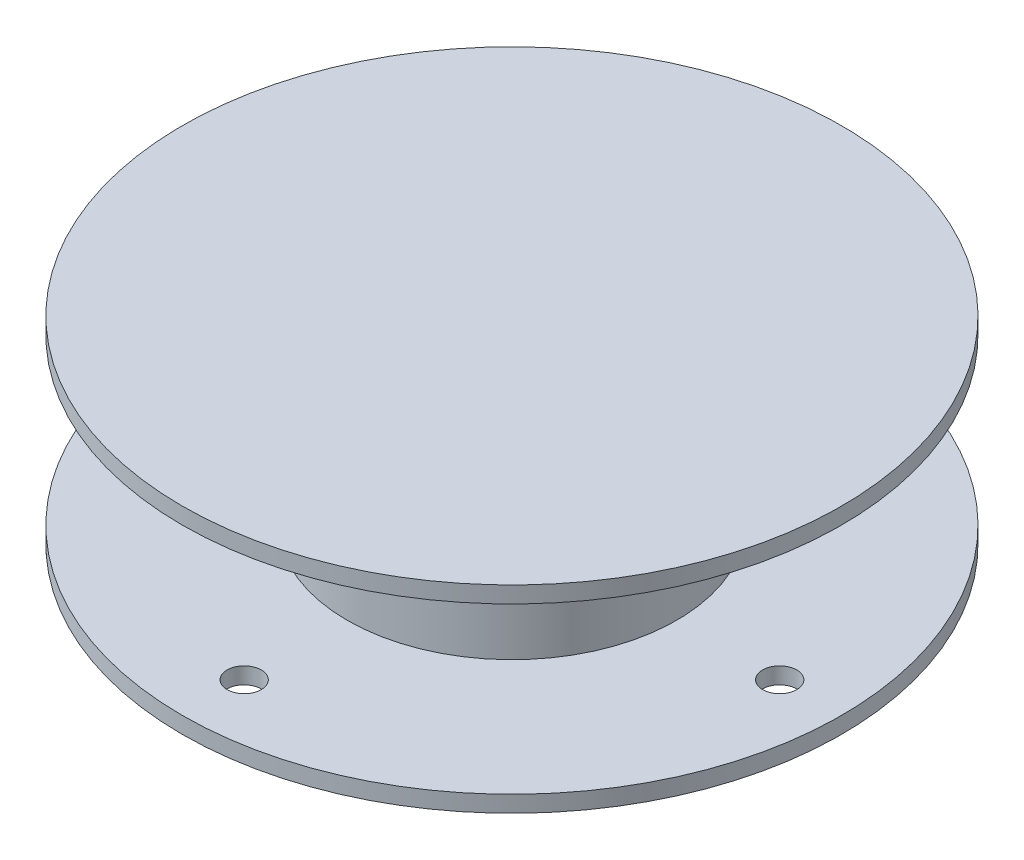
from build123d import *

# Parameters (mm, degrees)
SKETCH1_R           = 40
BOSS_EXTRUDE1_DEPTH = 2
SKETCH2_R           = 20
BOSS_EXTRUDE2_DEPTH = 10
CUT_EXTRUDE1_REACH  = 63.449
SKETCH3_R           = 2.073577671


with BuildPart() as part:
    # Sketch1 → Boss-Extrude1 (new body)
    with BuildSketch(Plane(origin=(0, 0, 0), x_dir=(1, 0, 0), z_dir=(0, 1, 0))):
        with Locations(Location((0, 0, 0), (0, 0, 270))):
            Circle(SKETCH1_R)
    boss_extrude1 = extrude(amount=BOSS_EXTRUDE1_DEPTH)

    # Sketch2 → Boss-Extrude2 (add)
    with BuildSketch(Plane(origin=(0, 2, 0), x_dir=(1, 0, 0), z_dir=(0, 1, 0))):
        with Locations(Location((0, 0, 0), (0, 0, 270))):
            Circle(SKETCH2_R)
    boss_extrude2 = extrude(amount=BOSS_EXTRUDE2_DEPTH)

    # Mirror1: Boss-Extrude1, Boss-Extrude2 across plane
    add(boss_extrude1.mirror(Plane.ZX.offset(12)))
    add(boss_extrude2.mirror(Plane.ZX.offset(12)))

    # Sketch3 → Cut-Extrude1 (cut, up to next)
    with BuildSketch(Plane.XZ, mode=Mode.PRIVATE) as cut_extrude1_sk1:
        with Locations(Location((0, 32.5, 0), (0, 0, 270))):
            Circle(SKETCH3_R)
    cut_extrude1_tool1 = extrude(cut_extrude1_sk1.sketch, amount=-CUT_EXTRUDE1_REACH, mode=Mode.PRIVATE) & part.part
    # Sketch3 → Cut-Extrude1 (cut, up to next)
    with BuildSketch(Plane.XZ, mode=Mode.PRIVATE) as cut_extrude1_sk2:
        with Locations(Location((32.5, 0, 0), (0, 0, 270))):
            Circle(SKETCH3_R)
    cut_extrude1_tool2 = extrude(cut_extrude1_sk2.sketch, amount=-CUT_EXTRUDE1_REACH, mode=Mode.PRIVATE) & part.part
    # Sketch3 → Cut-Extrude1 (cut, up to next)
    with BuildSketch(Plane.XZ, mode=Mode.PRIVATE) as cut_extrude1_sk3:
        with Locations(Location((0, -32.5, 0), (0, 0, 270))):
            Circle(SKETCH3_R)
    cut_extrude1_tool3 = extrude(cut_extrude1_sk3.sketch, amount=-CUT_EXTRUDE1_REACH, mode=Mode.PRIVATE) & part.part
    # Sketch3 → Cut-Extrude1 (cut, up to next)
    with BuildSketch(Plane.XZ, mode=Mode.PRIVATE) as cut_extrude1_sk4:
        with Locations(Location((-32.5, 0, 0), (0, 0, 270))):
            Circle(SKETCH3_R)
    cut_extrude1_tool4 = extrude(cut_extrude1_sk4.sketch, amount=-CUT_EXTRUDE1_REACH, mode=Mode.PRIVATE) & part.part
    add(cut_extrude1_tool1.solids().sort_by_distance((0, 0, 32.5))[0], mode=Mode.SUBTRACT)
    add(cut_extrude1_tool2.solids().sort_by_distance((32.5, 0, 0))[0], mode=Mode.SUBTRACT)
    add(cut_extrude1_tool3.solids().sort_by_distance((0, 0, -32.5))[0], mode=Mode.SUBTRACT)
    add(cut_extrude1_tool4.solids().sort_by_distance((-32.5, 0, 0))[0], mode=Mode.SUBTRACT)


solid = part.part
